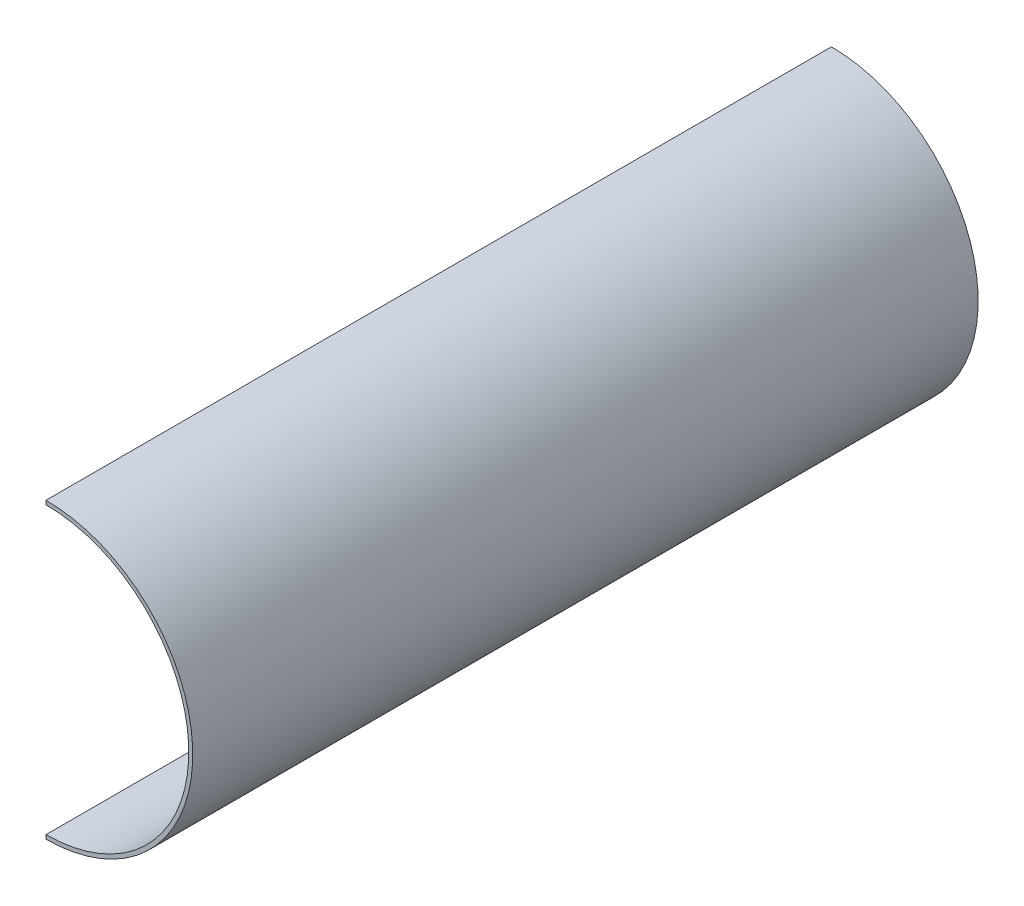
from build123d import *

# Parameters (mm, degrees)
SKETCH1_R           = 18.5
BOSS_EXTRUDE1_DEPTH = 99
CUT_EXTRUDE1_START  = -99
CUT_EXTRUDE1_DEPTH  = 99


with BuildPart() as part:
    # Sketch1 → Boss-Extrude1 (new body)
    with BuildSketch(Plane.XY):
        Circle(SKETCH1_R)
    extrude(amount=BOSS_EXTRUDE1_DEPTH)

    # Sketch2 → Cut-Extrude1 (cut)
    with BuildSketch(Plane.XY.offset(99).offset(CUT_EXTRUDE1_START)):
        with BuildLine():
            Line((0, 18.5), (0, 18))
            ThreePointArc((0, 18), (18, 0), (0, -18))
            Line((0, -18), (0, -18.5))
            ThreePointArc((0, -18.5), (-18.5, 0), (0, 18.5))
        make_face()
    extrude(amount=CUT_EXTRUDE1_DEPTH, mode=Mode.SUBTRACT)


solid = part.part
